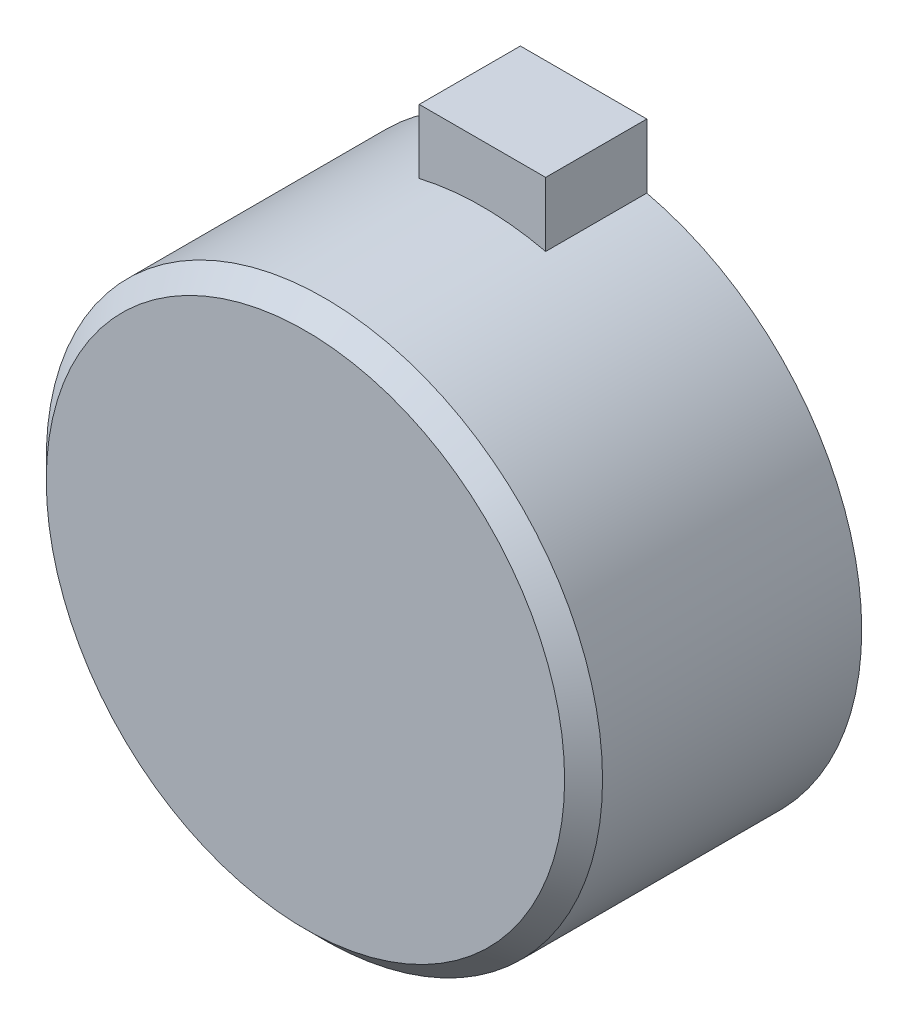
from build123d import *

# Parameters (mm, degrees)
SK_REARHOLE_R           = 1.25
REAR_TAPPED_HOLE_DEPTH  = 8
REAR_HOLE_PATTERN_COUNT = 6
SK_CONNECTOR_W          = 20
SK_CONNECTOR_H          = 13
CONNECTOR_ZONE_DEPTH    = 16


with BuildPart() as part:
    # SK_Body → Housing_Body (revolve)
    with BuildSketch(Plane(origin=(0, 0, 0), x_dir=(1, 0, 0), z_dir=(0, 1, 0))):
        Polygon((0, 0), (41, 0), (44, 3), (44, 44), (41, 44), (0, 44), align=None)
    revolve(axis=Axis((0, 0, 10), (0, 0, -1)))

    # SK_RearHole → Rear_Tapped_Hole (cut)
    with BuildSketch(Plane.XY.offset(-44)):
        with Locations((37, 0)):
            Circle(SK_REARHOLE_R)
    rear_tapped_hole = extrude(amount=REAR_TAPPED_HOLE_DEPTH, mode=Mode.SUBTRACT)

    # Rear_Hole_Pattern: Rear_Tapped_Hole ×6 about axis
    rear_hole_pattern_axis = Axis((0, 0, -46.2), (0, 0, 1))
    for i in range(1, REAR_HOLE_PATTERN_COUNT):
        add(rear_tapped_hole.rotate(rear_hole_pattern_axis, i * 360 / REAR_HOLE_PATTERN_COUNT), mode=Mode.SUBTRACT)

    # SK_Connector → Connector_Zone (add)
    with BuildSketch(Plane.XY.offset(-44)):
        with Locations((0, 46.5)):
            Rectangle(SK_CONNECTOR_W, SK_CONNECTOR_H)
    extrude(amount=CONNECTOR_ZONE_DEPTH)


solid = part.part
